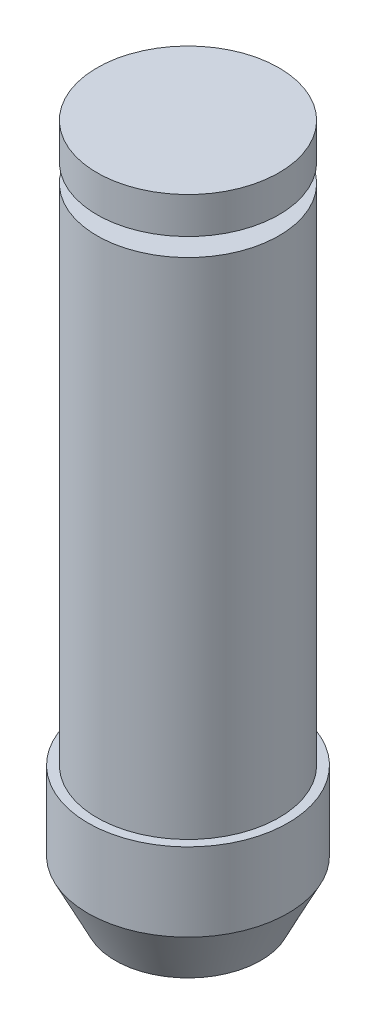
from build123d import *


with BuildPart() as part:
    # 草图1 → 旋转1 (revolve)
    with BuildSketch(Plane.XY, mode=Mode.PRIVATE) as revolve_1_sk:
        Polygon((0, 0), (-40, 0), (-55, 30), (-55, 73), (-50, 73), (-50, 350), (-35, 350), (-35, 360), (-50, 360), (-50, 380), (0, 380), align=None)
    revolve(revolve_1_sk.sketch.rotate(Axis((0, -1000, 0), (0, 1, 0)), 270), axis=Axis((0, -1000, 0), (0, 1, 0)))


solid = part.part
